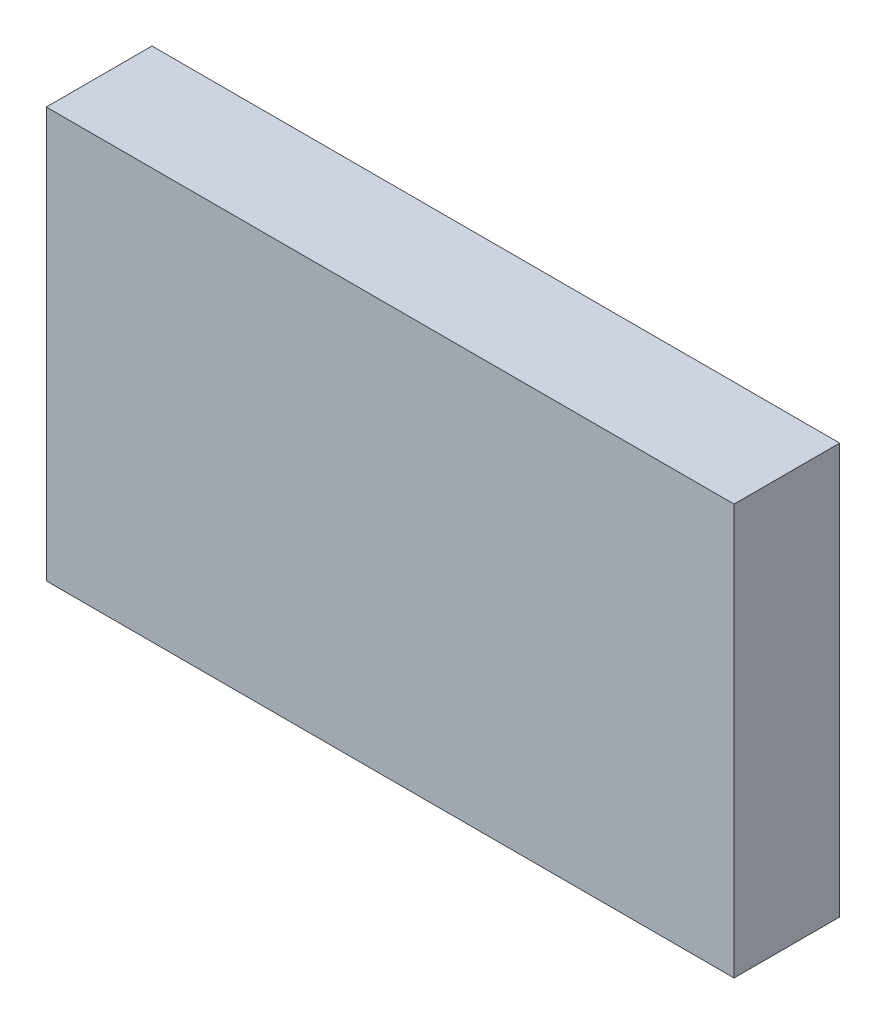
from build123d import *

# Parameters (mm, degrees)
SKETCH1_W           = 31
SKETCH1_H           = 18.5
BOSS_EXTRUDE1_DEPTH = 4.7625


with BuildPart() as part:
    # Sketch1 → Boss-Extrude1 (new body)
    with BuildSketch(Plane.XY):
        Rectangle(SKETCH1_W, SKETCH1_H)
    extrude(amount=BOSS_EXTRUDE1_DEPTH)


solid = part.part
